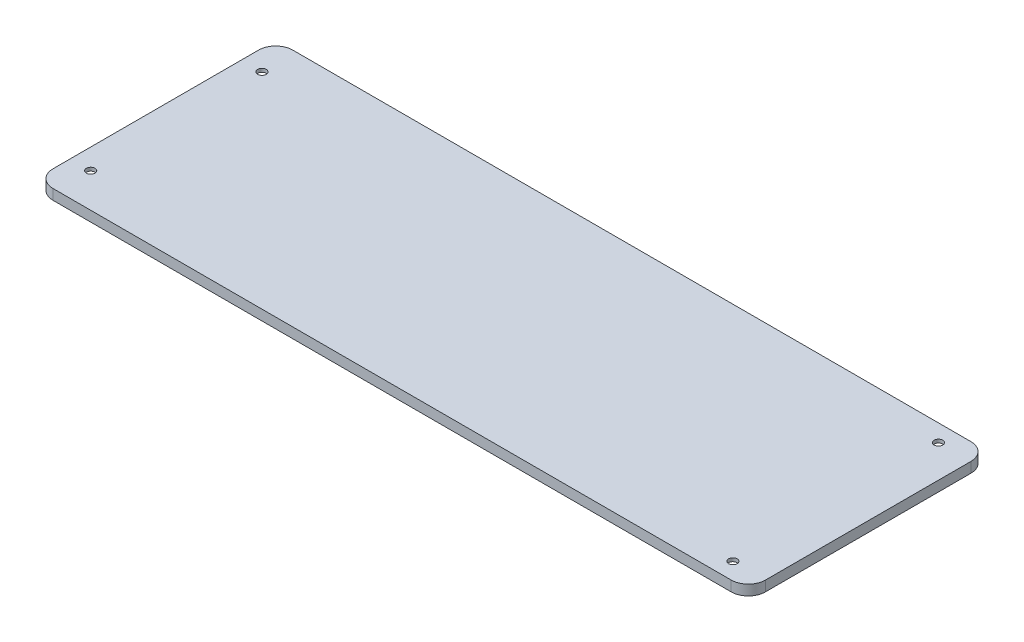
from build123d import *

# Parameters (mm, degrees)
SKETCH1_W           = 208
SKETCH1_H           = 70
SKETCH1_R           = 1.25
BOSS_EXTRUDE1_DEPTH = 3
FILLET1_R           = 5
SKETCH2_R           = 5
SKETCH2_R_2         = 4.75
CUT_EXTRUDE2_DEPTH  = 2


with BuildPart() as part:
    # Sketch1 → Boss-Extrude1 (new body)
    with BuildSketch(Plane(origin=(0, 0, 0), x_dir=(1, 0, 0), z_dir=(0, 1, 0))):
        Rectangle(SKETCH1_W, SKETCH1_H)
        with Locations(Location((-98, 25, 0), (0, 0, 270))):
            Circle(SKETCH1_R, mode=Mode.SUBTRACT)
        with Locations(Location((-98, -25, 0), (0, 0, 270))):
            Circle(SKETCH1_R, mode=Mode.SUBTRACT)
        with Locations(Location((94.5, 30, 0), (0, 0, 270))):
            Circle(SKETCH1_R, mode=Mode.SUBTRACT)
        with Locations(Location((94.5, -30, 0), (0, 0, 270))):
            Circle(SKETCH1_R, mode=Mode.SUBTRACT)
    extrude(amount=BOSS_EXTRUDE1_DEPTH)

    # Fillet1
    fillet1_edges = [part.edges().sort_by_distance(p)[0] for p in [
        (104, 1.5, 35),
        (-104, 1.5, 35),
        (-104, 1.5, -35),
        (104, 1.5, -35),
    ]]
    fillet(fillet1_edges, radius=FILLET1_R)

    # Sketch2 → Cut-Extrude2 (cut)
    with BuildSketch(Plane(origin=(0, 0, 0), x_dir=(1, 0, 0), z_dir=(0, 1, 0))):
        with Locations(Location((-98, 25, 0), (0, 0, 270))):
            Circle(SKETCH2_R)
        with Locations(Location((94.5, 30, 0), (0, 0, 270))):
            Circle(SKETCH2_R_2)
        with Locations(Location((94.5, -30, 0), (0, 0, 270))):
            Circle(SKETCH2_R_2)
        with Locations(Location((-98, -25, 0), (0, 0, 270))):
            Circle(SKETCH2_R)
    extrude(amount=CUT_EXTRUDE2_DEPTH, mode=Mode.SUBTRACT)


solid = part.part
